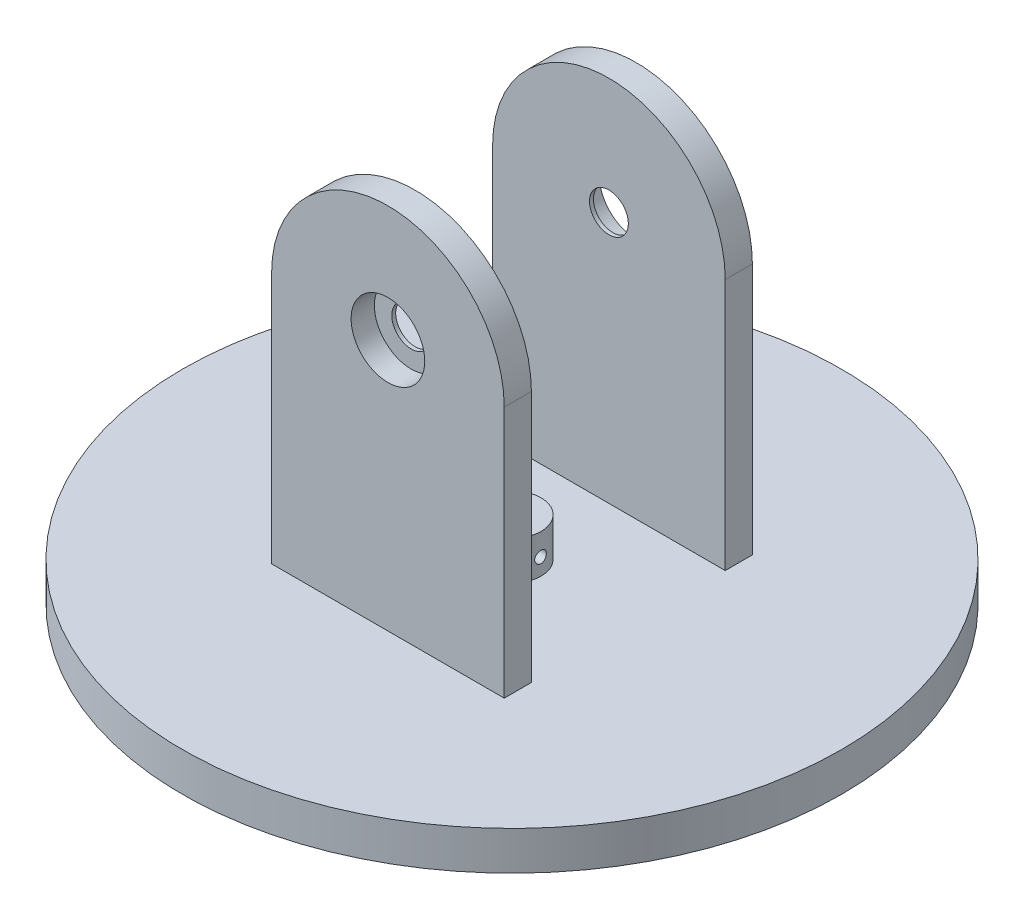
from build123d import *

# Parameters (mm, degrees)
BOSS_EXTRUDE1_DEPTH = 32
SKETCH5_R           = 9.5
CUT_EXTRUDE2_DEPTH  = 6
CUT_EXTRUDE5_START  = -6
SKETCH12_R          = 9.5
CUT_EXTRUDE5_DEPTH  = 6
SKETCH8_W           = 50
SKETCH8_H           = 95
CUT_EXTRUDE3_DEPTH  = 117.828934772
SKETCH10_R          = 1.5
CUT_EXTRUDE4_DEPTH  = 158.5
FILLET1_R           = 1
SKETCH13_R          = 5
CUT_EXTRUDE6_DEPTH  = 170.02958321


with BuildPart() as part:
    # Sketch1 → Boss-Extrude1 (new, symmetric)
    with BuildSketch(Plane.XY):
        with BuildLine():
            Line((-30, 0), (30, 0))
            Line((30, 0), (30, 65))
            ThreePointArc((30, 65), (0, 95), (-30, 65))
            Line((-30, 65), (-30, 0))
        make_face()
    extrude(amount=BOSS_EXTRUDE1_DEPTH, both=True)

    # Sketch5 → Cut-Extrude2 (cut)
    with BuildSketch(Plane.XY.offset(32)):
        with Locations((0, 65)):
            Circle(SKETCH5_R)
    extrude(amount=-CUT_EXTRUDE2_DEPTH, mode=Mode.SUBTRACT)

    # Sketch12 → Cut-Extrude5 (cut)
    with BuildSketch(Plane(origin=(0, 0, -32), x_dir=(-1, 0, 0), z_dir=(0, 0, -1)).offset(CUT_EXTRUDE5_START)):
        with Locations(Location((0, 65, 0), (0, 0, 180))):
            Circle(SKETCH12_R)
    extrude(amount=CUT_EXTRUDE5_DEPTH, mode=Mode.SUBTRACT)

    # Sketch8 → Cut-Extrude3 (cut, through all)
    with BuildSketch(Plane.ZY.offset(30)):
        with Locations((0, 47.5)):
            Rectangle(SKETCH8_W, SKETCH8_H)
    extrude(amount=-CUT_EXTRUDE3_DEPTH, mode=Mode.SUBTRACT)


with BuildPart() as cut_extrude3_piece_1:
    # of the separate pieces the step leaves, piece 1, a body of its own (cut_extrude3_pieces)
    add(part.part.solids().sort_by_distance((-30, 0, 32))[0])

    # Sketch6 → Revolve1 (revolve)
    with BuildSketch(Plane.XY):
        Polygon((7.5, 0), (85, 0), (85, -10), (35, -10), (35, -5), (25, -5), (25, -15), (3, -15), (3, 10), (7.5, 10), align=None)
    revolve(axis=Axis((0, -9.444930419, 0), (0, 1, 0)))

    # Sketch10 → Cut-Extrude4 (cut, through all)
    with BuildSketch(Plane(origin=(7.5, 0, 0), x_dir=(0, 0, -1), z_dir=(1, 0, 0))):
        with Locations(Location((0, 4.3, 0), (0, 0, 90))):
            Circle(SKETCH10_R)
    extrude(amount=-CUT_EXTRUDE4_DEPTH, mode=Mode.SUBTRACT)

    # Fillet1
    fillet1_edges = [cut_extrude3_piece_1.edges().sort_by_distance(p)[0] for p in [
        (-25, -15, 0),
    ]]
    fillet(fillet1_edges, radius=FILLET1_R)


with BuildPart() as cut_extrude3_piece_2:
    # of the separate pieces the step leaves, piece 2, a body of its own (cut_extrude3_pieces)
    add(part.part.solids().sort_by_distance((-30, 0, -25))[0])


with BuildPart() as cut_extrude6_tool:
    # Sketch13 → Cut-Extrude6 (new, through all)
    with BuildSketch(Plane.XY.offset(26)):
        with Locations(Location((0, 65, 0), (0, 0, 180))):
            Circle(SKETCH13_R)
    extrude(amount=-CUT_EXTRUDE6_DEPTH)


with BuildPart() as cut_extrude3_piece_1_1:
    add(cut_extrude3_piece_1.part)

    # Cut-Extrude6: cut by cut_extrude6_tool
    add(cut_extrude6_tool.part, mode=Mode.SUBTRACT)


with BuildPart() as cut_extrude3_piece_2_1:
    add(cut_extrude3_piece_2.part)

    # Cut-Extrude6: cut by cut_extrude6_tool
    add(cut_extrude6_tool.part, mode=Mode.SUBTRACT)


solid = Compound([cut_extrude3_piece_1_1.part, cut_extrude3_piece_2_1.part])
